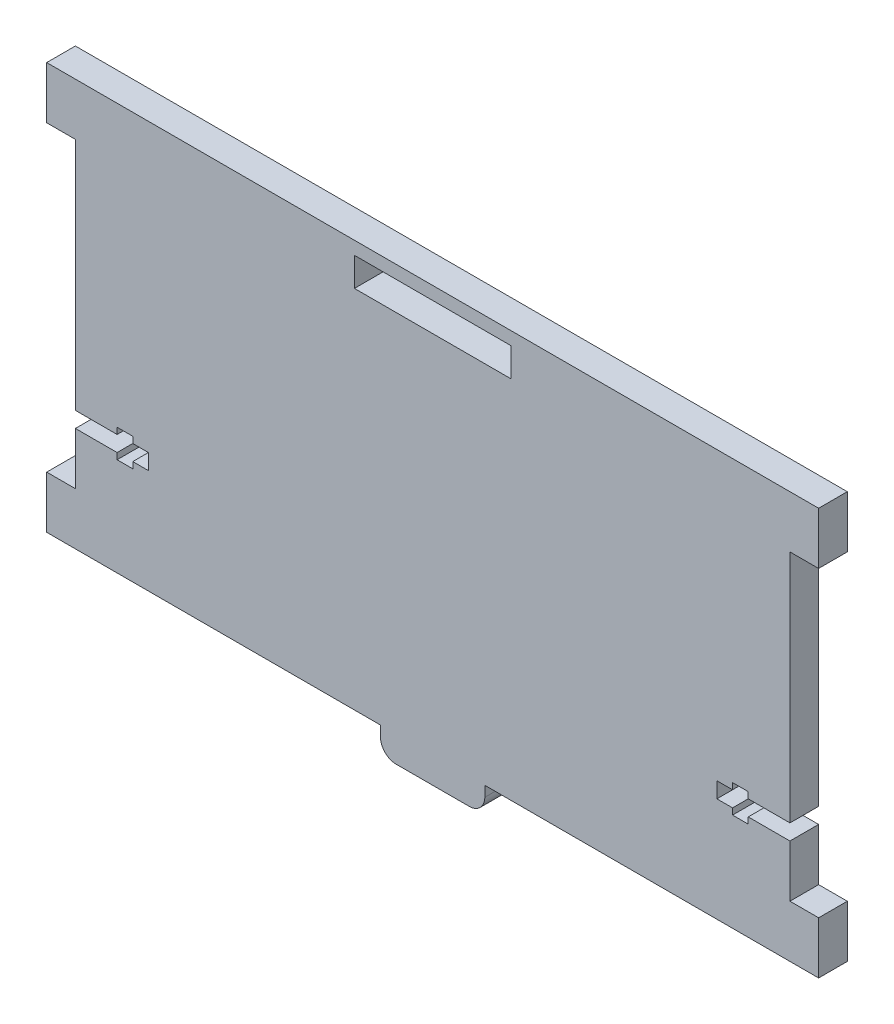
from build123d import *

# Parameters (mm, degrees)
SKETCH1_W           = 30
SKETCH1_H           = 5.5
BOSS_EXTRUDE2_DEPTH = 5.5
FILLET1_R           = 3
FILLET2_R           = 3


with BuildPart() as part:
    # Sketch1 → Boss-Extrude2 (new body)
    with BuildSketch(Plane.XY):
        Polygon((78.5, 0), (137, 0), (142.5, 0), (142.5, 10), (137, 10), (137, 20), (129, 20), (129, 18.8), (126, 18.8), (126, 20), (123, 20), (123, 23), (126, 23), (126, 24.2), (129, 24.2), (129, 23), (137, 23), (137, 68), (142.5, 68), (142.5, 78), (137, 78), (0, 78), (-5.5, 78), (-5.5, 68), (0, 68), (0, 23), (8, 23), (8, 24.2), (11, 24.2), (11, 23), (14, 23), (14, 20), (11, 20), (11, 18.8), (8, 18.8), (8, 20), (0, 20), (0, 10), (-5.5, 10), (-5.5, 0), (0, 0), (58.5, 0), (58.5, -5), (78.5, -5), align=None)
        with Locations((68.5, 72.75)):
            Rectangle(SKETCH1_W, SKETCH1_H, mode=Mode.SUBTRACT)
    extrude(amount=BOSS_EXTRUDE2_DEPTH)

    # Fillet1
    fillet1_edges = [part.edges().sort_by_distance(p)[0] for p in [
        (78.5, -5, 2.75),
    ]]
    fillet(fillet1_edges, radius=FILLET1_R)

    # Fillet2
    fillet2_edges = [part.edges().sort_by_distance(p)[0] for p in [
        (58.5, -5, 2.75),
    ]]
    fillet(fillet2_edges, radius=FILLET2_R)


solid = part.part
